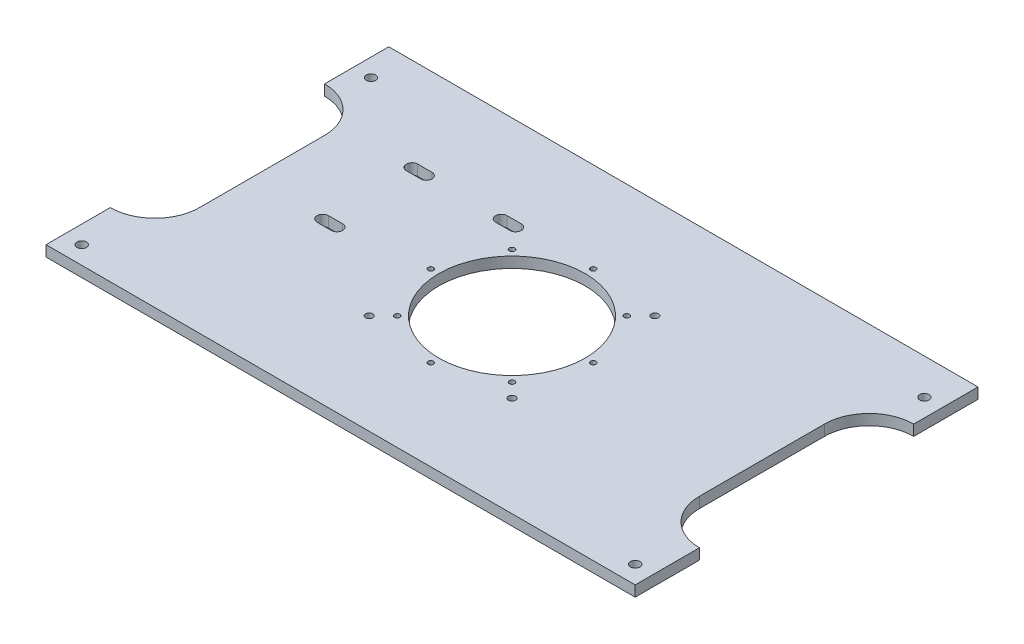
from build123d import *

# Parameters (mm, degrees)
SKETCH1_W                = 330
SKETCH1_H                = 192
BOSS_EXTRUDE1_DEPTH      = 6
CUT_EXTRUDE1_DEPTH       = 382.837661841
CUT_EXTRUDE1_DEPTH_BACK  = 382.837661841
SKETCH2_R                = 1.5
SKETCH3_R                = 41
CUT_EXTRUDE2_DEPTH       = 382.837661841
CUT_EXTRUDE5_DEPTH       = 10
SKETCH11_R               = 2
CUT_EXTRUDE6_DEPTH       = 10
M5_CLEARANCE_HOLE1_D     = 5.3
M5_CLEARANCE_HOLE1_DEPTH = 11.94
M5_CLEARANCE_HOLE1_TIP   = 1.59228064
CUT_EXTRUDE10_DEPTH      = 382.837661841


with BuildPart() as part:
    # Sketch1 → Boss-Extrude1 (new body)
    with BuildSketch(Plane(origin=(0, 0, 0), x_dir=(1, 0, 0), z_dir=(0, 1, 0))):
        with Locations((165, 96)):
            Rectangle(SKETCH1_W, SKETCH1_H)
    extrude(amount=BOSS_EXTRUDE1_DEPTH)

    # Sketch2 → Cut-Extrude1 (cut, two sides: drawn at the far end of the back side and taken through both)
    with BuildSketch(Plane(origin=(0, 6, 0), x_dir=(1, 0, 0), z_dir=(0, 1, 0)).offset(-CUT_EXTRUDE1_DEPTH_BACK)):
        with Locations(Location((165, 141.5, 0), (0, 0, 270))):
            Circle(SKETCH2_R)
        with Locations(Location((197.173358544, 128.173358544, 0), (0, 0, 270))):
            Circle(SKETCH2_R)
        with Locations(Location((210.5, 96, 0), (0, 0, 270))):
            Circle(SKETCH2_R)
        with Locations(Location((165, 50.5, 0), (0, 0, 270))):
            Circle(SKETCH2_R)
        with Locations(Location((132.826641456, 63.826641456, 0), (0, 0, 270))):
            Circle(SKETCH2_R)
        with Locations(Location((119.5, 96, 0), (0, 0, 270))):
            Circle(SKETCH2_R)
        with Locations(Location((132.826641456, 128.173358544, 0), (0, 0, 270))):
            Circle(SKETCH2_R)
        with Locations(Location((197.173358544, 63.826641456, 0), (0, 0, 270))):
            Circle(SKETCH2_R)
    extrude(amount=CUT_EXTRUDE1_DEPTH + CUT_EXTRUDE1_DEPTH_BACK, mode=Mode.SUBTRACT)

    # Sketch3 → Cut-Extrude2 (cut, through all)
    with BuildSketch(Plane(origin=(0, 6, 0), x_dir=(1, 0, 0), z_dir=(0, 1, 0))):
        with Locations(Location((165, 96, 0), (0, 0, 270))):
            Circle(SKETCH3_R)
    extrude(amount=-CUT_EXTRUDE2_DEPTH, mode=Mode.SUBTRACT)

    # Sketch10 → Cut-Extrude5 (cut)
    with BuildSketch(Plane.XZ):
        with BuildLine():
            Line((123, -136.8), (115, -136.8))
            ThreePointArc((115, -136.8), (111.8, -140), (115, -143.2))
            Line((115, -143.2), (123, -143.2))
            ThreePointArc((123, -143.2), (126.2, -140), (123, -136.8))
        make_face()
        with BuildLine():
            Line((73, -136.8), (65, -136.8))
            ThreePointArc((65, -136.8), (61.8, -140), (65, -143.2))
            Line((65, -143.2), (73, -143.2))
            ThreePointArc((73, -143.2), (76.2, -140), (73, -136.8))
        make_face()
        with BuildLine():
            Line((73, -86.8), (65, -86.8))
            ThreePointArc((65, -86.8), (61.8, -90), (65, -93.2))
            Line((65, -93.2), (73, -93.2))
            ThreePointArc((73, -93.2), (76.2, -90), (73, -86.8))
        make_face()
    extrude(amount=-CUT_EXTRUDE5_DEPTH, mode=Mode.SUBTRACT)

    # Sketch11 → Cut-Extrude6 (cut)
    with BuildSketch(Plane.XZ):
        with Locations(Location((125, -56, 0), (0, 0, 270))):
            Circle(SKETCH11_R)
        with Locations(Location((205, -56, 0), (0, 0, 270))):
            Circle(SKETCH11_R)
        with Locations(Location((205, -136, 0), (0, 0, 270))):
            Circle(SKETCH11_R)
    extrude(amount=-CUT_EXTRUDE6_DEPTH, mode=Mode.SUBTRACT)

    # M5 Clearance Hole1
    with Locations(Plane(origin=(0, 6, 0), x_dir=(1, 0, 0), z_dir=(0, 1, 0))):
        with Locations((10, 172), (10, 10), (320, 10), (320, 172)):
            Hole(M5_CLEARANCE_HOLE1_D / 2, depth=M5_CLEARANCE_HOLE1_DEPTH)
            with Locations((0, 0, -(M5_CLEARANCE_HOLE1_DEPTH + M5_CLEARANCE_HOLE1_TIP / 2))):  # 118° drill point
                Cone(0, M5_CLEARANCE_HOLE1_D / 2, M5_CLEARANCE_HOLE1_TIP, mode=Mode.SUBTRACT)

    # Sketch19 → Cut-Extrude10 (cut, through all)
    with BuildSketch(Plane(origin=(0, 6, 0), x_dir=(1, 0, 0), z_dir=(0, 1, 0))):
        with BuildLine():
            Line((25, 131), (25, 61))
            ThreePointArc((25, 61), (0, 36), (-25, 61))
            Line((-25, 61), (-25, 131))
            ThreePointArc((-25, 131), (0, 156), (25, 131))
        make_face()
        with BuildLine():
            Line((305, 131), (305, 61))
            ThreePointArc((305, 61), (330, 36), (355, 61))
            Line((355, 61), (355, 131))
            ThreePointArc((355, 131), (330, 156), (305, 131))
        make_face()
    extrude(amount=-CUT_EXTRUDE10_DEPTH, mode=Mode.SUBTRACT)


solid = part.part
